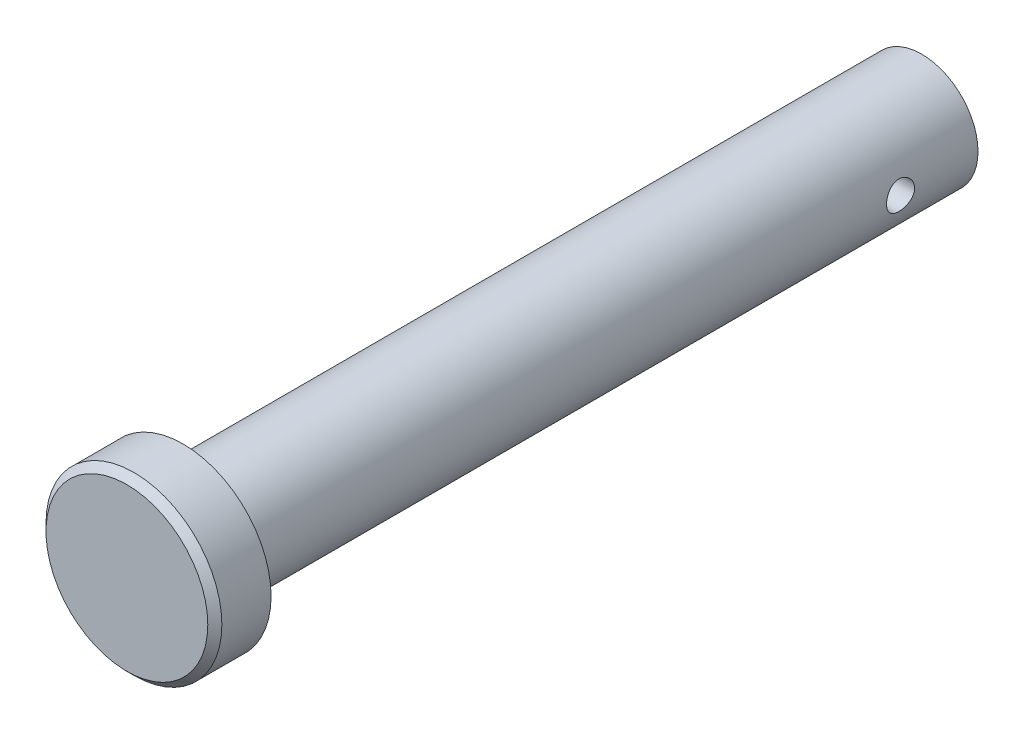
from build123d import *

# Parameters (mm, degrees)
SKETCH1_R           = 8
BOSS_EXTRUDE1_DEPTH = 105
SKETCH2_R           = 12.5
BOSS_EXTRUDE2_DEPTH = 8
CHAMFER1_SIZE       = 1
SKETCH3_R           = 2
CUT_EXTRUDE1_DEPTH  = 500


with BuildPart() as part:
    # Sketch1 → Boss-Extrude1 (new body)
    with BuildSketch(Plane.XY):
        Circle(SKETCH1_R)
    extrude(amount=BOSS_EXTRUDE1_DEPTH)

    # Sketch2 → Boss-Extrude2 (add)
    with BuildSketch(Plane.XY.offset(105)):
        Circle(SKETCH2_R)
    extrude(amount=BOSS_EXTRUDE2_DEPTH)

    # Chamfer1
    chamfer1_edges = [part.edges().sort_by_distance(p)[0] for p in [
        (-12.5, 0, 113),
    ]]
    chamfer(chamfer1_edges, length=CHAMFER1_SIZE)

    # Sketch3 → Cut-Extrude1 (cut, symmetric)
    with BuildSketch(Plane(origin=(0, 0, 0), x_dir=(0, 0, -1), z_dir=(1, 0, 0))):
        with Locations(Location((-11, 0, 0), (0, 0, 180))):
            Circle(SKETCH3_R)
    extrude(amount=CUT_EXTRUDE1_DEPTH, both=True, mode=Mode.SUBTRACT)


solid = part.part
